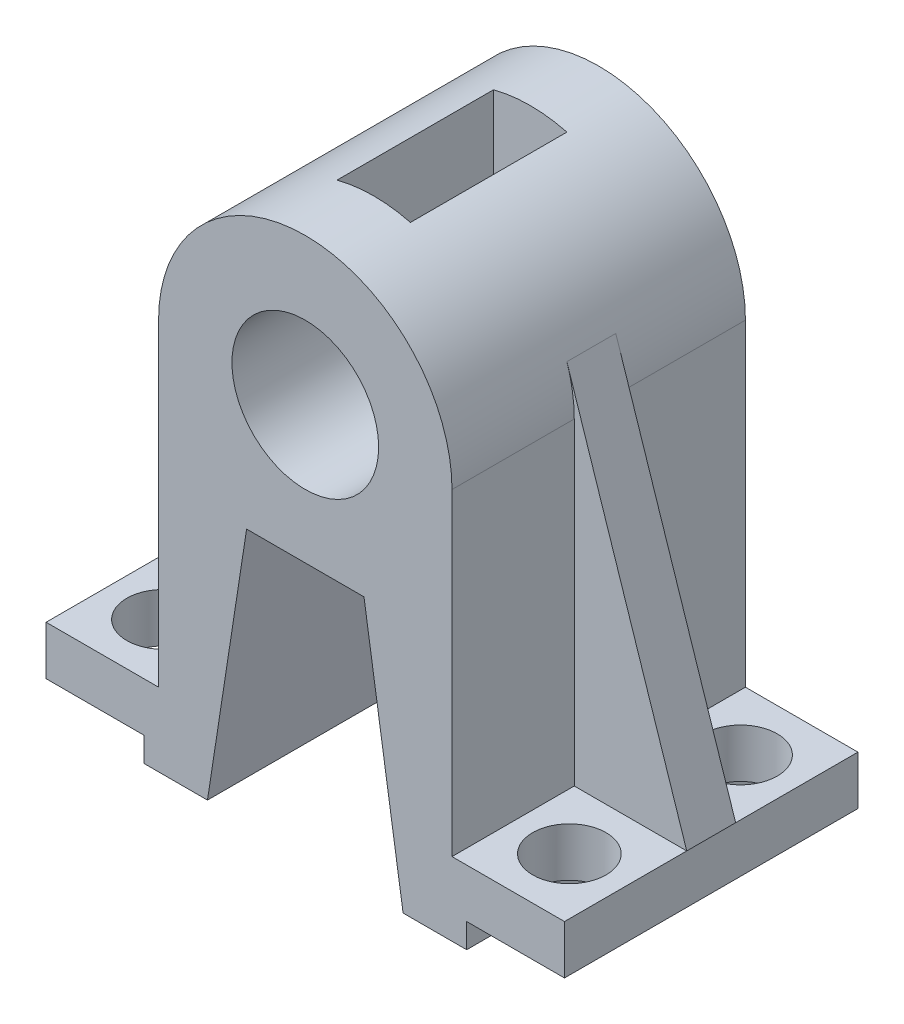
from build123d import *

# Parameters (mm, degrees)
SKETCH1_R           = 15
BOSS_EXTRUDE1_DEPTH = 60
SKETCH2_R           = 7.5
CUT_EXTRUDE1_DEPTH  = 125.233650836
SKETCH3_W           = 15
SKETCH3_H           = 32
CUT_EXTRUDE2_DEPTH  = 114.176852757
RIB3_REACH          = 127.734
SKETCH4_WALL_W      = 331.787548758
SKETCH4_WALL_H      = 10


with BuildPart() as part:
    # Sketch1 → Boss-Extrude1 (new body)
    with BuildSketch(Plane.XY):
        with BuildLine():
            Line((-12, 52), (12, 52))
            Line((12, 52), (20, 0))
            Line((20, 0), (33, 0))
            Line((33, 0), (33, 5))
            Line((33, 5), (53, 5))
            Line((53, 5), (53, 15))
            Line((53, 15), (30, 15))
            Line((30, 15), (30, 80))
            ThreePointArc((30, 80), (0, 110), (-30, 80))
            Line((-30, 80), (-30, 15))
            Line((-30, 15), (-53, 15))
            Line((-53, 15), (-53, 5))
            Line((-53, 5), (-33, 5))
            Line((-33, 5), (-33, 0))
            Line((-33, 0), (-20, 0))
            Line((-20, 0), (-12, 52))
        make_face()
        with Locations((0, 80)):
            Circle(SKETCH1_R, mode=Mode.SUBTRACT)
    extrude(amount=BOSS_EXTRUDE1_DEPTH)

    # Sketch2 → Cut-Extrude1 (cut, through all)
    with BuildSketch(Plane(origin=(0, 15, 0), x_dir=(1, 0, 0), z_dir=(0, 1, 0))):
        with Locations(Location((-41.5, -12.5, 0), (0, 0, 180))):
            Circle(SKETCH2_R)
        with Locations(Location((-41.5, -47.5, 0), (0, 0, 180))):
            Circle(SKETCH2_R)
        with Locations(Location((41.5, -47.5, 0), (0, 0, 270))):
            Circle(SKETCH2_R)
        with Locations(Location((41.5, -12.5, 0), (0, 0, 270))):
            Circle(SKETCH2_R)
    extrude(amount=-CUT_EXTRUDE1_DEPTH, mode=Mode.SUBTRACT)

    # Sketch3 → Cut-Extrude2 (cut, through all)
    with BuildSketch(Plane(origin=(0, 80, 0), x_dir=(1, 0, 0), z_dir=(0, 1, 0))):
        with Locations((0, -30)):
            Rectangle(SKETCH3_W, SKETCH3_H)
    extrude(amount=CUT_EXTRUDE2_DEPTH, mode=Mode.SUBTRACT)

    # Sketch4 wall → Rib3 (add, up to next)
    with BuildSketch(Plane(origin=(40.746781429, 52.193529473, 30), x_dir=(0.312901964861, -0.949785428603, 0), z_dir=(0.949785428603, 0.312901964861, 0)), mode=Mode.PRIVATE) as rib3_sk1:
        Rectangle(SKETCH4_WALL_W, SKETCH4_WALL_H)
    rib3_tool1 = extrude(rib3_sk1.sketch, amount=-RIB3_REACH, mode=Mode.PRIVATE) - part.part
    rib3 = rib3_tool1.solids().sort_by_distance((40.746781429, 52.193529473, 30))[0]
    add(rib3)

    # Mirror1: Rib3 across plane
    add(rib3.mirror(Plane(origin=(0, 0, 0), x_dir=(0, 0, 1), z_dir=(1, 0, 0))))


solid = part.part
